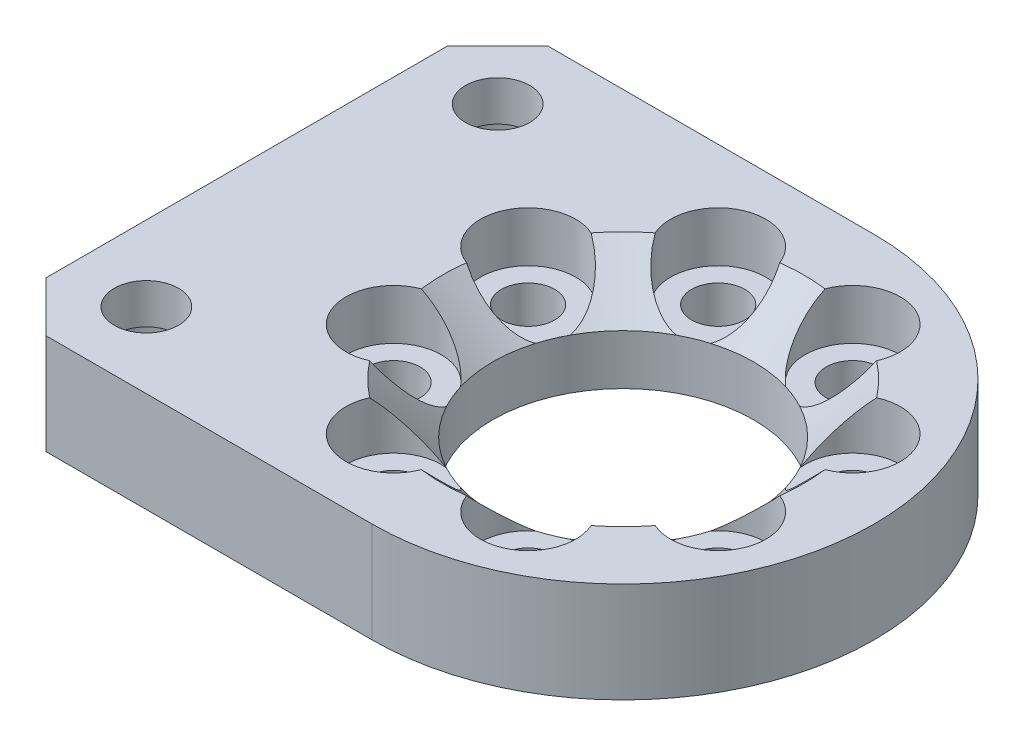
from build123d import *

# Parameters (mm, degrees)
SKETCH1_W                      = 75
SKETCH1_H                      = 50
BOSS_EXTRUDE1_DEPTH            = 5
CUT_EXTRUDE1_REACH             = 48.165
SKETCH2_R                      = 13
CHAMFER1_SIZE                  = 5
CBORE_FOR_M5_SHCS1_D           = 5.3
CBORE_FOR_M5_SHCS1_CBORE_D     = 9.5
CBORE_FOR_M5_SHCS1_CBORE_DEPTH = 5
CIRPATTERN1_COUNT              = 8
CBORE_FOR_M6_SHCS1_D           = 6.4
CBORE_FOR_M6_SHCS1_CBORE_D     = 11
CBORE_FOR_M6_SHCS1_CBORE_DEPTH = 6
CHAMFER2_SIZE                  = 5
CUT_EXTRUDE2_DEPTH             = 10


with BuildPart() as part:
    # Sketch1 → Boss-Extrude1 (new, symmetric)
    with BuildSketch(Plane(origin=(0, 0, 0), x_dir=(1, 0, 0), z_dir=(0, 1, 0))):
        Rectangle(SKETCH1_W, SKETCH1_H)
    extrude(amount=BOSS_EXTRUDE1_DEPTH, both=True)

    # Sketch2 → Cut-Extrude1 (cut, up to next)
    with BuildSketch(Plane(origin=(0, 5, 0), x_dir=(1, 0, 0), z_dir=(0, 1, 0)), mode=Mode.PRIVATE) as cut_extrude1_sk1:
        with Locations(Location((0, 0, 0), (0, 0, 270))):
            Circle(SKETCH2_R)
    cut_extrude1_tool1 = extrude(cut_extrude1_sk1.sketch, amount=-CUT_EXTRUDE1_REACH, mode=Mode.PRIVATE) & part.part
    add(cut_extrude1_tool1.solids().sort_by_distance((0, 5, 0))[0], mode=Mode.SUBTRACT)

    # Chamfer1
    chamfer1_edges = [part.edges().sort_by_distance(p)[0] for p in [
        (0, 5, -13),
    ]]
    chamfer(chamfer1_edges, length=CHAMFER1_SIZE)

    # CBORE for M5 SHCS1 (through all)
    with Locations(Plane(origin=(0, 5, 0), x_dir=(1, 0, 0), z_dir=(0, 1, 0))):
        with Locations((-6.696960066, 16.167891819)):
            cbore_for_m5_shcs1 = CounterBoreHole(CBORE_FOR_M5_SHCS1_D / 2, CBORE_FOR_M5_SHCS1_CBORE_D / 2, CBORE_FOR_M5_SHCS1_CBORE_DEPTH)

    # CirPattern1: CBORE for M5 SHCS1 ×8 about axis
    cirpattern1_axis = Axis((0, 0, 0), (0, 1, 0))
    for i in range(1, CIRPATTERN1_COUNT):
        add(cbore_for_m5_shcs1.rotate(cirpattern1_axis, i * 360 / CIRPATTERN1_COUNT), mode=Mode.SUBTRACT)

    # CBORE for M6 SHCS1 (through all)
    with Locations(Plane(origin=(0, -5, 0), x_dir=(-1, 0, 0), z_dir=(0, -1, 0))):
        with Locations((30, -17.5), (30, 17.5)):
            CounterBoreHole(CBORE_FOR_M6_SHCS1_D / 2, CBORE_FOR_M6_SHCS1_CBORE_D / 2, CBORE_FOR_M6_SHCS1_CBORE_DEPTH)

    # Chamfer2
    chamfer2_edges = [part.edges().sort_by_distance(p)[0] for p in [
        (-37.5, 0, 25),
        (-37.5, 0, -25),
    ]]
    chamfer(chamfer2_edges, length=CHAMFER2_SIZE)

    # Sketch10 → Cut-Extrude2 (cut)
    with BuildSketch(Plane(origin=(0, 5, 0), x_dir=(1, 0, 0), z_dir=(0, 1, 0))):
        with BuildLine():
            ThreePointArc((0, 25), (17.67766953, 17.67766953), (25, 0))
            ThreePointArc((25, 0), (17.677669539, -17.67766952), (2.6e-08, -25))
            Line((2.6e-08, -25), (37.5, -25))
            Line((37.5, -25), (37.5, 25))
            Line((37.5, 25), (0, 25))
        make_face()
    extrude(amount=-CUT_EXTRUDE2_DEPTH, mode=Mode.SUBTRACT)


solid = part.part
